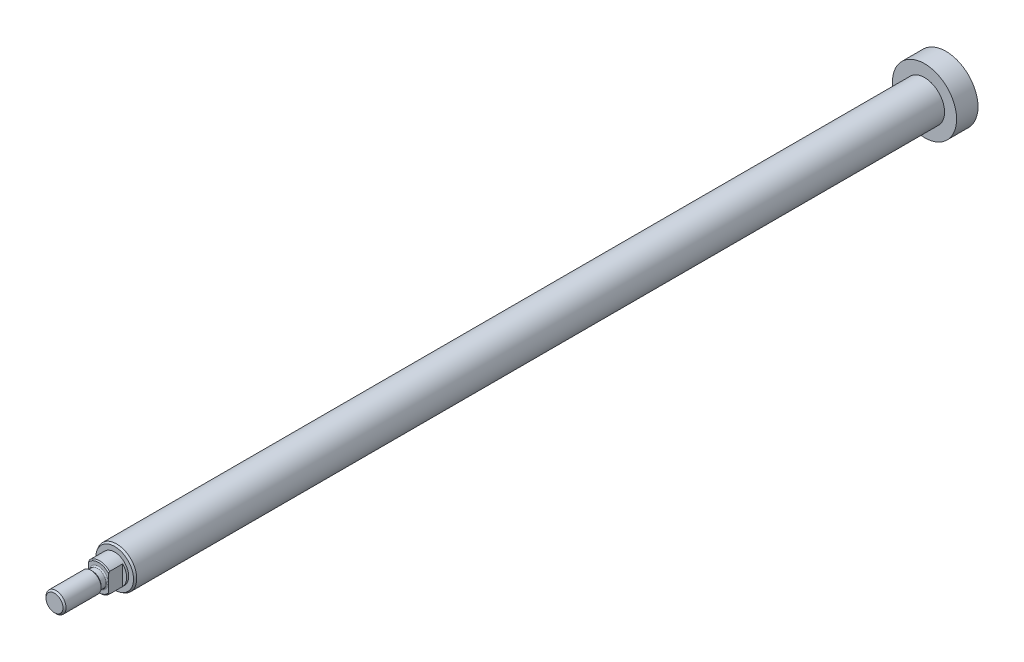
from build123d import *

# Parameters (mm, degrees)
CUT_EXTRUDE1_DEPTH      = 14
CUT_EXTRUDE1_DEPTH_BACK = 14


with BuildPart() as part:
    # Sketch1 → Revolve1 (revolve)
    with BuildSketch(Plane(origin=(0, 0, 0), x_dir=(0, 0, -1), z_dir=(1, 0, 0))):
        Polygon((-25.5, 0), (-25.5, 6.5), (-25, 7), (-17.5, 7), (-17.5, 9.422649731), (-16.5, 10), (386.333333333, 10), (386.333333333, 16), (397, 16), (397, 0), align=None)
    revolve(axis=Axis((0, 0, -397), (0, 0, 1)))

    # Sketch2 → Cut-Extrude1 (cut, two sides: drawn at the far end of the back side and taken through both)
    with BuildSketch(Plane(origin=(0, 0, 0), x_dir=(1, 0, 0), z_dir=(0, 1, 0)).offset(-CUT_EXTRUDE1_DEPTH_BACK)):
        Polygon((-8, -18.5), (-8, -28.5), (8, -28.5), (8, -18.5), (5, -18.5), (5, -25.5), (-5, -25.5), (-5, -18.5), align=None)
    extrude(amount=CUT_EXTRUDE1_DEPTH + CUT_EXTRUDE1_DEPTH_BACK, mode=Mode.SUBTRACT)

    # Sketch3 → Revolve2 (revolve)
    with BuildSketch(Plane(origin=(0, 0, 0), x_dir=(0, 0, -1), z_dir=(1, 0, 0))):
        with BuildLine():
            Line((-47.5, 0), (-47.5, 4.233))
            Line((-47.5, 4.233), (-46.733, 5))
            Line((-46.733, 5), (-29.267, 5))
            Line((-29.267, 5), (-28.5, 4.233))
            Line((-28.5, 4.233), (-26.1, 4.233))
            ThreePointArc((-26.1, 4.233), (-25.675735931, 4.408735931), (-25.5, 4.833))
            Line((-25.5, 4.833), (-25.5, 0))
            Line((-25.5, 0), (-47.5, 0))
        make_face()
    revolve(axis=Axis((0, 0, 25.5), (0, 0, 1)))


solid = part.part
